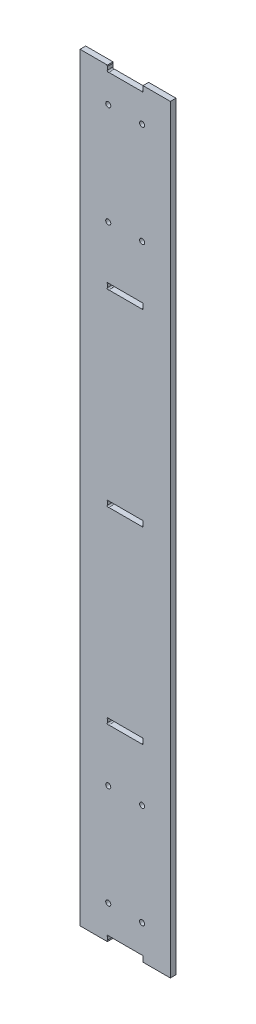
from build123d import *

# Parameters (mm, degrees)
SKETCH1_W           = 50.8
SKETCH1_H           = 3.175
BOSS_EXTRUDE1_DEPTH = 427.1518
SKETCH4_R           = 1.4224
CUT_EXTRUDE2_DEPTH  = 5.08
SKETCH5_W           = 12.58267919
SKETCH5_H           = 101.029760921
BOSS_EXTRUDE2_DEPTH = 3.175
SKETCH6_W           = 7.546607927
SKETCH6_H           = 108.671154153
SKETCH6_W_2         = 9.055929513
BOSS_EXTRUDE3_DEPTH = 3.175
SKETCH7_W           = 50.8
SKETCH7_H           = 16.51
BOSS_EXTRUDE4_DEPTH = 3.175
SKETCH8_W           = 50.8
SKETCH8_H           = 51.188017092
BOSS_EXTRUDE5_DEPTH = 3.175
SKETCH9_W           = 50.8
SKETCH9_H           = 70.169066632
BOSS_EXTRUDE6_DEPTH = 3.175
CUT_EXTRUDE3_DEPTH  = 428.918100655


with BuildPart() as part:
    # Sketch1 → Boss-Extrude1 (new body)
    with BuildSketch(Plane(origin=(0, 0, 0), x_dir=(1, 0, 0), z_dir=(0, 1, 0))):
        with Locations((0, 70.254548969)):
            Rectangle(SKETCH1_W, SKETCH1_H)
    extrude(amount=BOSS_EXTRUDE1_DEPTH)

    # Sketch4 → Cut-Extrude2 (cut)
    with BuildSketch(Plane.XY.offset(-68.667048969)):
        with Locations((-3.175, 376.3518)):
            Circle(SKETCH4_R)
        with Locations((-9.525, 376.3518)):
            Circle(SKETCH4_R)
        with Locations((-9.525, 370.0018)):
            Circle(SKETCH4_R)
        with Locations((-9.525, 363.6518)):
            Circle(SKETCH4_R)
        with Locations((-9.525, 357.3018)):
            Circle(SKETCH4_R)
        with Locations((-9.525, 350.9518)):
            Circle(SKETCH4_R)
        with Locations((-9.525, 344.6018)):
            Circle(SKETCH4_R)
        with Locations((-9.525, 338.2518)):
            Circle(SKETCH4_R)
        with Locations((-9.525, 331.9018)):
            Circle(SKETCH4_R)
        with Locations((-9.525, 325.5518)):
            Circle(SKETCH4_R)
        with Locations((-9.525, 319.2018)):
            Circle(SKETCH4_R)
        with Locations((-9.525, 312.8518)):
            Circle(SKETCH4_R)
        with Locations((-9.525, 306.5018)):
            Circle(SKETCH4_R)
        with Locations((-9.525, 300.1518)):
            Circle(SKETCH4_R)
        with Locations((-9.525, 293.8018)):
            Circle(SKETCH4_R)
        with Locations((-9.525, 287.4518)):
            Circle(SKETCH4_R)
        with Locations((-9.525, 281.1018)):
            Circle(SKETCH4_R)
        with Locations((-3.175, 370.0018)):
            Circle(SKETCH4_R)
        with Locations((-3.175, 363.6518)):
            Circle(SKETCH4_R)
        with Locations((-3.175, 357.3018)):
            Circle(SKETCH4_R)
        with Locations((-3.175, 350.9518)):
            Circle(SKETCH4_R)
        with Locations((-3.175, 344.6018)):
            Circle(SKETCH4_R)
        with Locations((-3.175, 338.2518)):
            Circle(SKETCH4_R)
        with Locations((-3.175, 331.9018)):
            Circle(SKETCH4_R)
        with Locations((-3.175, 325.5518)):
            Circle(SKETCH4_R)
        with Locations((-3.175, 319.2018)):
            Circle(SKETCH4_R)
        with Locations((-3.175, 312.8518)):
            Circle(SKETCH4_R)
        with Locations((-3.175, 306.5018)):
            Circle(SKETCH4_R)
        with Locations((-3.175, 300.1518)):
            Circle(SKETCH4_R)
        with Locations((-3.175, 293.8018)):
            Circle(SKETCH4_R)
        with Locations((-3.175, 287.4518)):
            Circle(SKETCH4_R)
        with Locations((-3.175, 281.1018)):
            Circle(SKETCH4_R)
        with Locations((3.175, 281.1018)):
            Circle(SKETCH4_R)
        with Locations((3.175, 287.4518)):
            Circle(SKETCH4_R)
        with Locations((3.175, 293.8018)):
            Circle(SKETCH4_R)
        with Locations((3.175, 300.1518)):
            Circle(SKETCH4_R)
        with Locations((3.175, 306.5018)):
            Circle(SKETCH4_R)
        with Locations((3.175, 312.8518)):
            Circle(SKETCH4_R)
        with Locations((3.175, 319.2018)):
            Circle(SKETCH4_R)
        with Locations((3.175, 325.5518)):
            Circle(SKETCH4_R)
        with Locations((3.175, 331.9018)):
            Circle(SKETCH4_R)
        with Locations((3.175, 338.2518)):
            Circle(SKETCH4_R)
        with Locations((3.175, 344.6018)):
            Circle(SKETCH4_R)
        with Locations((3.175, 350.9518)):
            Circle(SKETCH4_R)
        with Locations((3.175, 357.3018)):
            Circle(SKETCH4_R)
        with Locations((3.175, 363.6518)):
            Circle(SKETCH4_R)
        with Locations((3.175, 370.0018)):
            Circle(SKETCH4_R)
        with Locations((9.525, 281.1018)):
            Circle(SKETCH4_R)
        with Locations((9.525, 287.4518)):
            Circle(SKETCH4_R)
        with Locations((9.525, 293.8018)):
            Circle(SKETCH4_R)
        with Locations((9.525, 300.1518)):
            Circle(SKETCH4_R)
        with Locations((9.525, 306.5018)):
            Circle(SKETCH4_R)
        with Locations((9.525, 312.8518)):
            Circle(SKETCH4_R)
        with Locations((9.525, 319.2018)):
            Circle(SKETCH4_R)
        with Locations((9.525, 325.5518)):
            Circle(SKETCH4_R)
        with Locations((9.525, 331.9018)):
            Circle(SKETCH4_R)
        with Locations((9.525, 338.2518)):
            Circle(SKETCH4_R)
        with Locations((9.525, 344.6018)):
            Circle(SKETCH4_R)
        with Locations((9.525, 350.9518)):
            Circle(SKETCH4_R)
        with Locations((9.525, 357.3018)):
            Circle(SKETCH4_R)
        with Locations((9.525, 363.6518)):
            Circle(SKETCH4_R)
        with Locations((9.525, 370.0018)):
            Circle(SKETCH4_R)
        with Locations((9.525, 376.3518)):
            Circle(SKETCH4_R)
        with Locations((3.175, 376.3518)):
            Circle(SKETCH4_R)
        with Locations((-9.525, 382.7018)):
            Circle(SKETCH4_R)
        with Locations((9.525, 382.7018)):
            Circle(SKETCH4_R)
        with Locations((-9.525, 389.0518)):
            Circle(SKETCH4_R)
        with Locations((9.525, 389.0518)):
            Circle(SKETCH4_R)
        with Locations((-9.525, 395.4018)):
            Circle(SKETCH4_R)
        with Locations((9.525, 395.4018)):
            Circle(SKETCH4_R)
        with Locations((-9.525, 401.7518)):
            Circle(SKETCH4_R)
        with Locations((9.525, 401.7518)):
            Circle(SKETCH4_R)
        with Locations((-9.525, 408.1018)):
            Circle(SKETCH4_R)
        with Locations((9.525, 408.1018)):
            Circle(SKETCH4_R)
        with Locations((-9.525, 414.4518)):
            Circle(SKETCH4_R)
        with Locations((9.525, 414.4518)):
            Circle(SKETCH4_R)
    cut_extrude2 = extrude(amount=-CUT_EXTRUDE2_DEPTH, mode=Mode.SUBTRACT)

    # Sketch5 → Boss-Extrude2 (add)
    with BuildSketch(Plane.XY.offset(-68.667048969)):
        with Locations((-0.175223229, 328.362881378)):
            Rectangle(SKETCH5_W, SKETCH5_H)
    boss_extrude2 = extrude(amount=-BOSS_EXTRUDE2_DEPTH)

    # Sketch6 → Boss-Extrude3 (add)
    with BuildSketch(Plane.XY.offset(-68.667048969)):
        with Locations((-16.484092579, 326.705642943)):
            Rectangle(SKETCH6_W, SKETCH6_H)
        with Locations((16.9725359, 326.705642943)):
            Rectangle(SKETCH6_W_2, SKETCH6_H)
    boss_extrude3 = extrude(amount=-BOSS_EXTRUDE3_DEPTH)

    # Sketch7 → Boss-Extrude4 (add)
    with BuildSketch(Plane.XY.offset(-68.667048969)):
        with Locations((0, 418.8968)):
            Rectangle(SKETCH7_W, SKETCH7_H)
    boss_extrude4 = extrude(amount=-BOSS_EXTRUDE4_DEPTH)

    # Sketch8 → Boss-Extrude5 (add)
    with BuildSketch(Plane.XY.offset(-68.667048969)):
        with Locations((0, 379.332910144)):
            Rectangle(SKETCH8_W, SKETCH8_H)
    boss_extrude5 = extrude(amount=-BOSS_EXTRUDE5_DEPTH)

    # Sketch9 → Boss-Extrude6 (add)
    with BuildSketch(Plane.XY.offset(-68.667048969)):
        with Locations((0, 312.515447534)):
            Rectangle(SKETCH9_W, SKETCH9_H)
    boss_extrude6 = extrude(amount=-BOSS_EXTRUDE6_DEPTH)

    # Mirror1: Cut-Extrude2, Boss-Extrude2, Boss-Extrude3, Boss-Extrude4, Boss-Extrude5, Boss-Extrude6 across plane
    add(cut_extrude2.mirror(Plane.ZX.offset(213.5759)), mode=Mode.SUBTRACT)
    add(boss_extrude2.mirror(Plane.ZX.offset(213.5759)))
    add(boss_extrude3.mirror(Plane.ZX.offset(213.5759)))
    add(boss_extrude4.mirror(Plane.ZX.offset(213.5759)))
    add(boss_extrude5.mirror(Plane.ZX.offset(213.5759)))
    add(boss_extrude6.mirror(Plane.ZX.offset(213.5759)))

    # Sketch11 → Cut-Extrude3 (cut, through all)
    with BuildSketch(Plane.XY.offset(-68.667048969)):
        with BuildLine():
            Line((9.292893219, 105.9942), (-9.292893219, 105.9942))
            ThreePointArc((-9.292893219, 105.9942), (-10, 105.9942), (-10, 106.701306781))
            Line((-10, 106.701306781), (-10, 108.462093219))
            ThreePointArc((-10, 108.462093219), (-10, 109.1692), (-9.292893219, 109.1692))
            Line((-9.292893219, 109.1692), (9.292893219, 109.1692))
            ThreePointArc((9.292893219, 109.1692), (10, 109.1692), (10, 108.462093219))
            Line((10, 108.462093219), (10, 106.701306781))
            ThreePointArc((10, 106.701306781), (10, 105.9942), (9.292893219, 105.9942))
        make_face()
        with BuildLine():
            Line((9.292893219, 0), (-9.292893219, 0))
            ThreePointArc((-9.292893219, 0), (-10, 0), (-10, 0.707106781))
            Line((-10, 0.707106781), (-10, 2.467893219))
            ThreePointArc((-10, 2.467893219), (-10, 3.175), (-9.292893219, 3.175))
            Line((-9.292893219, 3.175), (9.292893219, 3.175))
            ThreePointArc((9.292893219, 3.175), (10, 3.175), (10, 2.467893219))
            Line((10, 2.467893219), (10, 0.707106781))
            ThreePointArc((10, 0.707106781), (10, 0), (9.292893219, 0))
        make_face()
        with BuildLine():
            Line((9.292893219, 211.9884), (-9.292893219, 211.9884))
            ThreePointArc((-9.292893219, 211.9884), (-10, 211.9884), (-10, 212.695506781))
            Line((-10, 212.695506781), (-10, 214.456293219))
            ThreePointArc((-10, 214.456293219), (-10, 215.1634), (-9.292893219, 215.1634))
            Line((-9.292893219, 215.1634), (9.292893219, 215.1634))
            ThreePointArc((9.292893219, 215.1634), (10, 215.1634), (10, 214.456293219))
            Line((10, 214.456293219), (10, 212.695506781))
            ThreePointArc((10, 212.695506781), (10, 211.9884), (9.292893219, 211.9884))
        make_face()
    cut_extrude3 = extrude(amount=-CUT_EXTRUDE3_DEPTH, mode=Mode.SUBTRACT)

    # Mirror2: Cut-Extrude3 across plane
    add(cut_extrude3.mirror(Plane(origin=(0, 213.5759, 0), x_dir=(0, 0, 1), z_dir=(0, -1, 0))), mode=Mode.SUBTRACT)


solid = part.part
